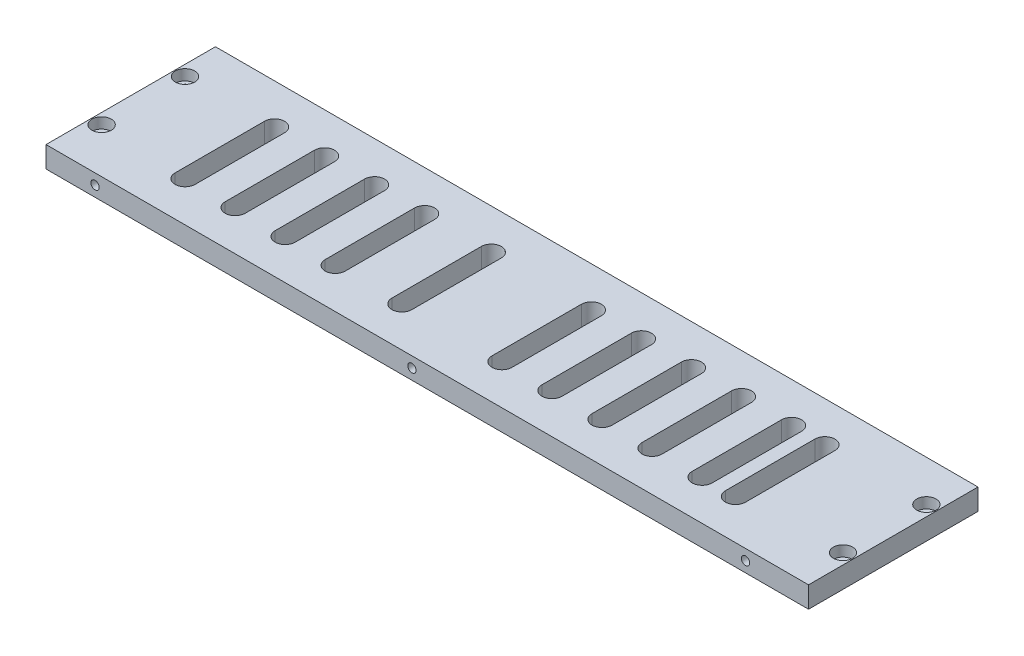
from build123d import *

# Parameters (mm, degrees)
PARED_Y_1_4IN_START          = 95.25
CROQUIS1_W                   = 228.6
CROQUIS1_H                   = 50.8
PARED_Y_1_4IN_DEPTH          = 6.35
ROSCA_M3_INFERIOR_START      = 12.7
CROQUIS2_R                   = 1.25
ROSCA_M3_INFERIOR_DEPTH      = 10
ROSCA_M3_SUPERIOR_START      = 53.5
CROQUIS3_R                   = 1.25
ROSCA_M3_SUPERIOR_DEPTH      = 10
BARRENOS_M3_ESQUINAS_START   = 95.25
CROQUIS4_R                   = 1.7
BARRENOS_M3_ESQUINAS_DEPTH   = 6.35
REFRENTADO_M3_ESQUINAS_START = 98.4
CROQUIS5_R                   = 2.9
REFRENTADO_M3_ESQUINAS_DEPTH = 3.2
RANURAS_VENTILACION_START    = 95.25
RANURAS_VENTILACION_DEPTH    = 6.35


with BuildPart() as part:
    # Croquis1 → Pared_+Y_1-4in (new body)
    with BuildSketch(Plane(origin=(0, 0, 0), x_dir=(1, 0, 0), z_dir=(0, 1, 0)).offset(PARED_Y_1_4IN_START)):
        with Locations((-25.4, -38.1)):
            Rectangle(CROQUIS1_W, CROQUIS1_H)
    extrude(amount=PARED_Y_1_4IN_DEPTH)

    # Croquis2 → Rosca_M3_inferior (cut)
    with BuildSketch(Plane.XY.offset(ROSCA_M3_INFERIOR_START)):
        with Locations((-125, 98.425)):
            Circle(CROQUIS2_R)
        with Locations((-30, 98.425)):
            Circle(CROQUIS2_R)
        with Locations((70, 98.425)):
            Circle(CROQUIS2_R)
    extrude(amount=ROSCA_M3_INFERIOR_DEPTH, mode=Mode.SUBTRACT)

    # Croquis3 → Rosca_M3_superior (cut)
    with BuildSketch(Plane.XY.offset(ROSCA_M3_SUPERIOR_START)):
        with Locations((-125, 98.425)):
            Circle(CROQUIS3_R)
        with Locations((-30, 98.425)):
            Circle(CROQUIS3_R)
        with Locations((70, 98.425)):
            Circle(CROQUIS3_R)
    extrude(amount=ROSCA_M3_SUPERIOR_DEPTH, mode=Mode.SUBTRACT)

    # Croquis4 → Barrenos_M3_esquinas (cut)
    with BuildSketch(Plane(origin=(0, 0, 0), x_dir=(1, 0, 0), z_dir=(0, 1, 0)).offset(BARRENOS_M3_ESQUINAS_START)):
        with Locations(Location((-136.525, -25, 0), (0, 0, 270))):
            Circle(CROQUIS4_R)
        with Locations(Location((-136.525, -50, 0), (0, 0, 270))):
            Circle(CROQUIS4_R)
        with Locations(Location((85.725, -25, 0), (0, 0, 270))):
            Circle(CROQUIS4_R)
        with Locations(Location((85.725, -50, 0), (0, 0, 270))):
            Circle(CROQUIS4_R)
    extrude(amount=BARRENOS_M3_ESQUINAS_DEPTH, mode=Mode.SUBTRACT)

    # Croquis5 → Refrentado_M3_esquinas (cut)
    with BuildSketch(Plane(origin=(0, 0, 0), x_dir=(1, 0, 0), z_dir=(0, 1, 0)).offset(REFRENTADO_M3_ESQUINAS_START)):
        with Locations(Location((-136.525, -25, 0), (0, 0, 270))):
            Circle(CROQUIS5_R)
        with Locations(Location((-136.525, -50, 0), (0, 0, 270))):
            Circle(CROQUIS5_R)
        with Locations(Location((85.725, -25, 0), (0, 0, 270))):
            Circle(CROQUIS5_R)
        with Locations(Location((85.725, -50, 0), (0, 0, 270))):
            Circle(CROQUIS5_R)
    extrude(amount=REFRENTADO_M3_ESQUINAS_DEPTH, mode=Mode.SUBTRACT)

    # Croquis6 → Ranuras_ventilacion (cut)
    with BuildSketch(Plane(origin=(0, 0, 0), x_dir=(1, 0, 0), z_dir=(0, 1, 0)).offset(RANURAS_VENTILACION_START)):
        with BuildLine():
            Line((-107, -24.7), (-107, -51.5))
            ThreePointArc((-107, -51.5), (-110, -54.5), (-113, -51.5))
            Line((-113, -51.5), (-113, -24.7))
            ThreePointArc((-113, -24.7), (-110, -21.7), (-107, -24.7))
        make_face()
        with BuildLine():
            Line((-92, -24.7), (-92, -51.5))
            ThreePointArc((-92, -51.5), (-95, -54.5), (-98, -51.5))
            Line((-98, -51.5), (-98, -24.7))
            ThreePointArc((-98, -24.7), (-95, -21.7), (-92, -24.7))
        make_face()
        with BuildLine():
            Line((-77, -24.7), (-77, -51.5))
            ThreePointArc((-77, -51.5), (-80, -54.5), (-83, -51.5))
            Line((-83, -51.5), (-83, -24.7))
            ThreePointArc((-83, -24.7), (-80, -21.7), (-77, -24.7))
        make_face()
        with BuildLine():
            Line((-62, -24.7), (-62, -51.5))
            ThreePointArc((-62, -51.5), (-65, -54.5), (-68, -51.5))
            Line((-68, -51.5), (-68, -24.7))
            ThreePointArc((-68, -24.7), (-65, -21.7), (-62, -24.7))
        make_face()
        with BuildLine():
            Line((-42, -24.7), (-42, -51.5))
            ThreePointArc((-42, -51.5), (-45, -54.5), (-48, -51.5))
            Line((-48, -51.5), (-48, -24.7))
            ThreePointArc((-48, -24.7), (-45, -21.7), (-42, -24.7))
        make_face()
        with BuildLine():
            Line((-12, -24.7), (-12, -51.5))
            ThreePointArc((-12, -51.5), (-15, -54.5), (-18, -51.5))
            Line((-18, -51.5), (-18, -24.7))
            ThreePointArc((-18, -24.7), (-15, -21.7), (-12, -24.7))
        make_face()
        with BuildLine():
            Line((3, -24.7), (3, -51.5))
            ThreePointArc((3, -51.5), (0, -54.5), (-3, -51.5))
            Line((-3, -51.5), (-3, -24.7))
            ThreePointArc((-3, -24.7), (0, -21.7), (3, -24.7))
        make_face()
        with BuildLine():
            Line((18, -24.7), (18, -51.5))
            ThreePointArc((18, -51.5), (15, -54.5), (12, -51.5))
            Line((12, -51.5), (12, -24.7))
            ThreePointArc((12, -24.7), (15, -21.7), (18, -24.7))
        make_face()
        with BuildLine():
            Line((33, -24.7), (33, -51.5))
            ThreePointArc((33, -51.5), (30, -54.5), (27, -51.5))
            Line((27, -51.5), (27, -24.7))
            ThreePointArc((27, -24.7), (30, -21.7), (33, -24.7))
        make_face()
        with BuildLine():
            Line((48, -24.7), (48, -51.5))
            ThreePointArc((48, -51.5), (45, -54.5), (42, -51.5))
            Line((42, -51.5), (42, -24.7))
            ThreePointArc((42, -24.7), (45, -21.7), (48, -24.7))
        make_face()
        with BuildLine():
            Line((58, -24.7), (58, -51.5))
            ThreePointArc((58, -51.5), (55, -54.5), (52, -51.5))
            Line((52, -51.5), (52, -24.7))
            ThreePointArc((52, -24.7), (55, -21.7), (58, -24.7))
        make_face()
    extrude(amount=RANURAS_VENTILACION_DEPTH, mode=Mode.SUBTRACT)


solid = part.part
